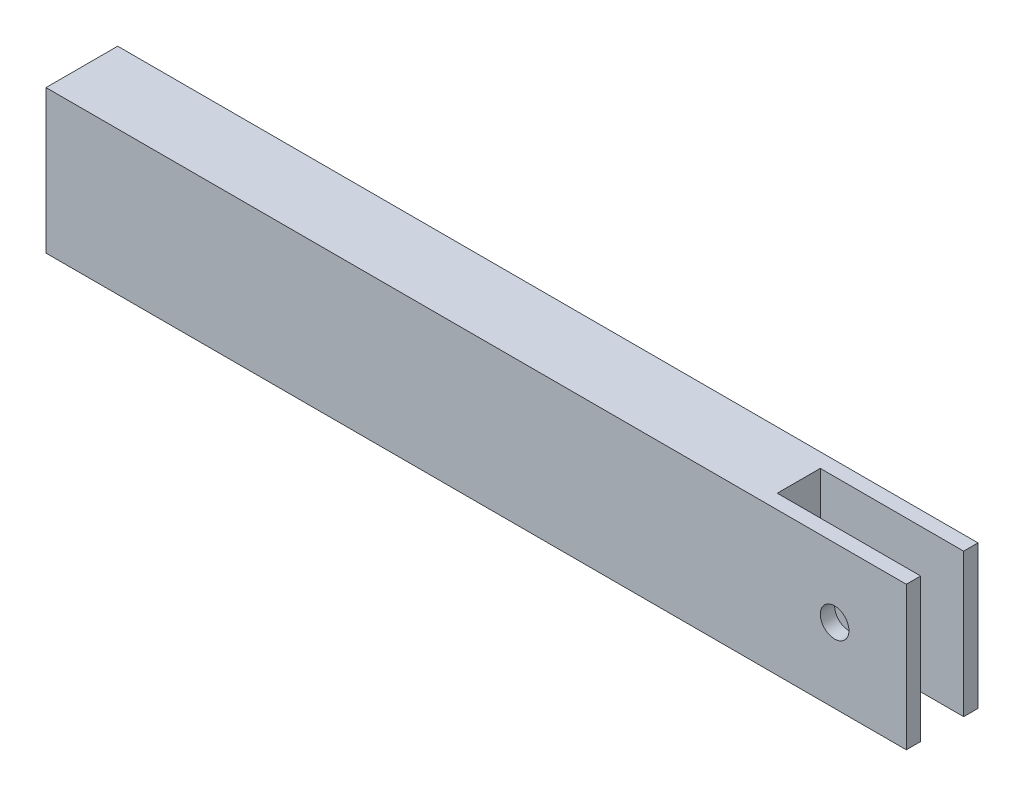
from build123d import *

# Parameters (mm, degrees)
SKETCH1_W               = 600
SKETCH1_H               = 100
BOSS_EXTRUDE1_DEPTH     = 50
SKETCH2_W               = 30
SKETCH2_H               = 100
CUT_EXTRUDE1_DEPTH      = 100
CUT_EXTRUDE3_DEPTH      = 610.590026165
CUT_EXTRUDE3_DEPTH_BACK = 610.590026165
SKETCH3_R               = 10


with BuildPart() as part:
    # Sketch1 → Boss-Extrude1 (new body)
    with BuildSketch(Plane.XY):
        with Locations((300, 50)):
            Rectangle(SKETCH1_W, SKETCH1_H)
    extrude(amount=BOSS_EXTRUDE1_DEPTH)

    # Sketch2 → Cut-Extrude1 (cut)
    with BuildSketch(Plane(origin=(600, 0, 0), x_dir=(0, 0, -1), z_dir=(1, 0, 0))):
        with Locations((-25, 50)):
            Rectangle(SKETCH2_W, SKETCH2_H)
    extrude(amount=-CUT_EXTRUDE1_DEPTH, mode=Mode.SUBTRACT)

    # Sketch3 → Cut-Extrude3 (cut, two sides: drawn at the far end of the back side and taken through both)
    with BuildSketch(Plane.XY.offset(10).offset(-CUT_EXTRUDE3_DEPTH_BACK)):
        with Locations((550, 51.950023211)):
            Circle(SKETCH3_R)
    extrude(amount=CUT_EXTRUDE3_DEPTH + CUT_EXTRUDE3_DEPTH_BACK, mode=Mode.SUBTRACT)


solid = part.part
